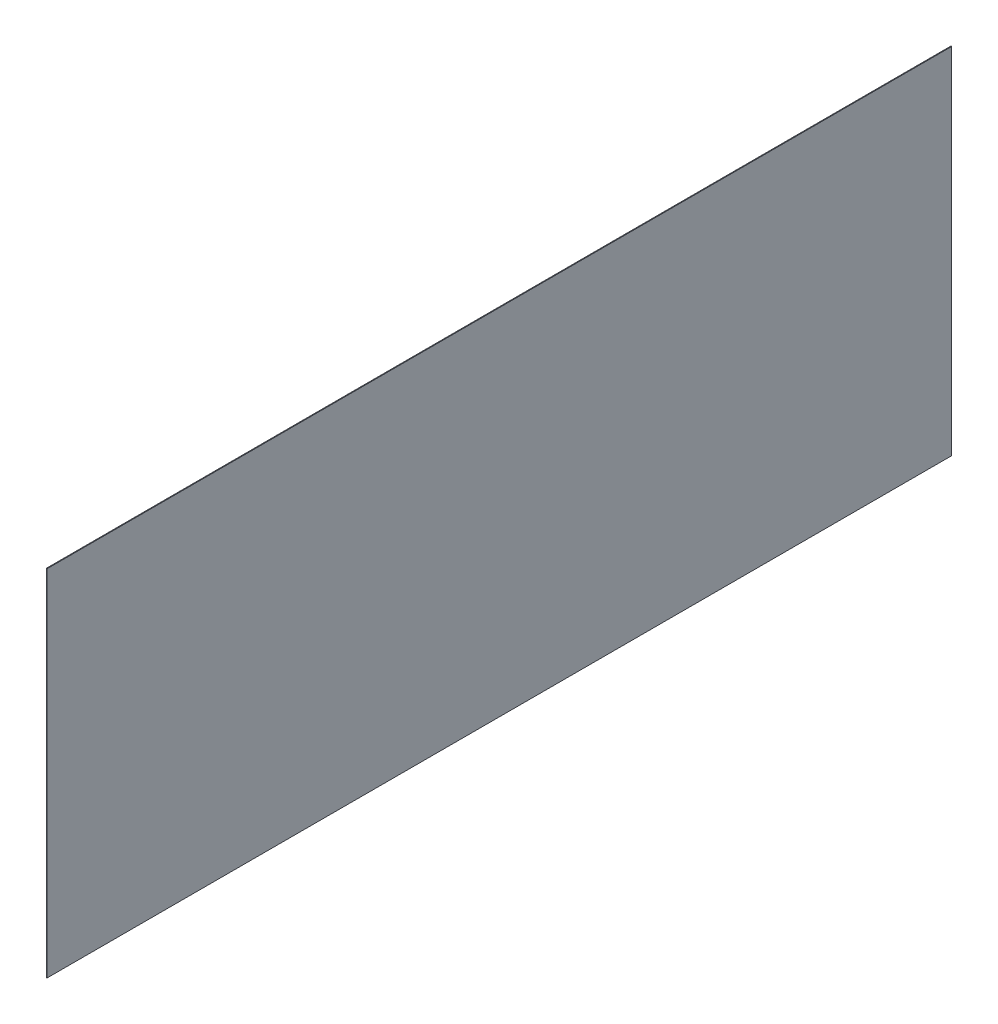
from build123d import *

# Parameters (mm, degrees)
SKETCH1_W           = 6018
SKETCH1_H           = 2358
BOSS_EXTRUDE1_DEPTH = 5


with BuildPart() as part:
    # Sketch1 → Boss-Extrude1 (new body)
    with BuildSketch(Plane(origin=(0, 0, 0), x_dir=(0, 0, -1), z_dir=(1, 0, 0))):
        Rectangle(SKETCH1_W, SKETCH1_H)
    extrude(amount=BOSS_EXTRUDE1_DEPTH)


solid = part.part
